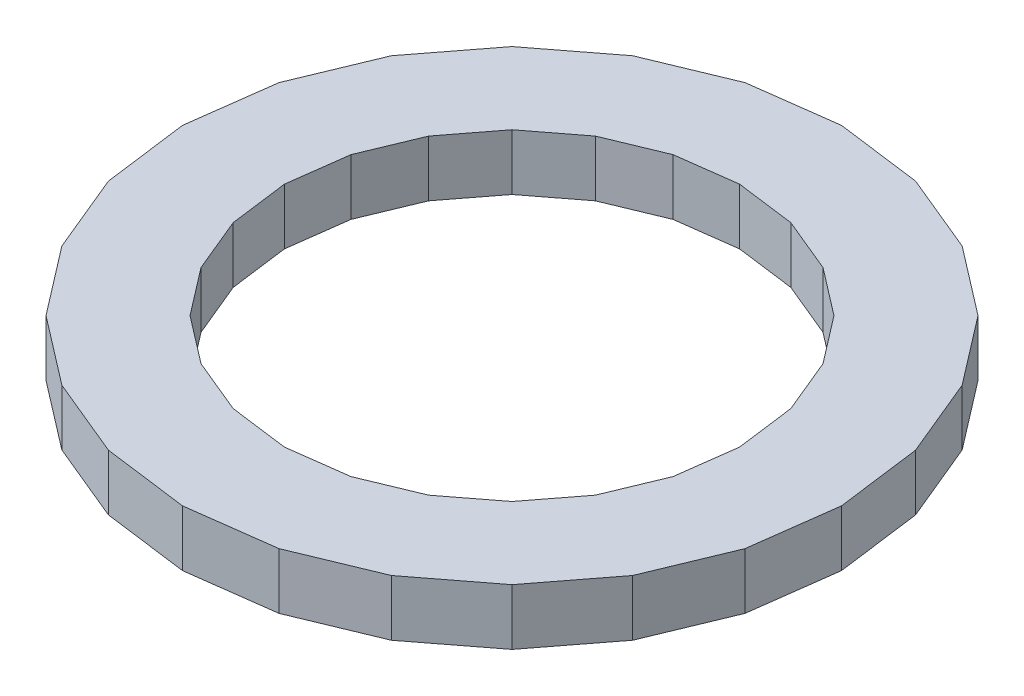
from build123d import *

# Parameters (mm, degrees)
BOSS_EXTRUDE1_DEPTH = 19.05


with BuildPart() as part:
    # Sketch1 → Boss-Extrude1 (new body)
    with BuildSketch(Plane(origin=(0, 0, 0), x_dir=(1, 0, 0), z_dir=(0, 1, 0))):
        Polygon((-111.893251091, 0), (-108.080581016, -28.960104401), (-96.902397957, -55.946625545), (-79.120476615, -79.120476615), (-55.946625545, -96.902397957), (-28.960104401, -108.080581016), (0, -111.893251091), (28.960104401, -108.080581016), (55.946625545, -96.902397957), (79.120476615, -79.120476615), (96.902397957, -55.946625545), (108.080581016, -28.960104401), (111.893251091, 0), (108.080581016, 28.960104401), (96.902397957, 55.946625545), (79.120476615, 79.120476615), (55.946625545, 96.902397957), (28.960104401, 108.080581016), (0, 111.893251091), (-28.960104401, 108.080581016), (-55.946625545, 96.902397957), (-79.120476615, 79.120476615), (-96.902397957, 55.946625545), (-108.080581016, 28.960104401), align=None)
        Polygon((77.307364032, 0), (74.673179481, 20.008618138), (66.950141152, 38.653682016), (54.664561343, 54.664561343), (38.653682016, 66.950141152), (20.008618138, 74.673179481), (0, 77.307364032), (-20.008618138, 74.673179481), (-38.653682016, 66.950141152), (-54.664561343, 54.664561343), (-66.950141152, 38.653682016), (-74.673179481, 20.008618138), (-77.307364032, 0), (-74.673179481, -20.008618138), (-66.950141152, -38.653682016), (-54.664561343, -54.664561343), (-38.653682016, -66.950141152), (-20.008618138, -74.673179481), (0, -77.307364032), (20.008618138, -74.673179481), (38.653682016, -66.950141152), (54.664561343, -54.664561343), (66.950141152, -38.653682016), (74.673179481, -20.008618138), align=None, mode=Mode.SUBTRACT)
    extrude(amount=BOSS_EXTRUDE1_DEPTH)


solid = part.part
